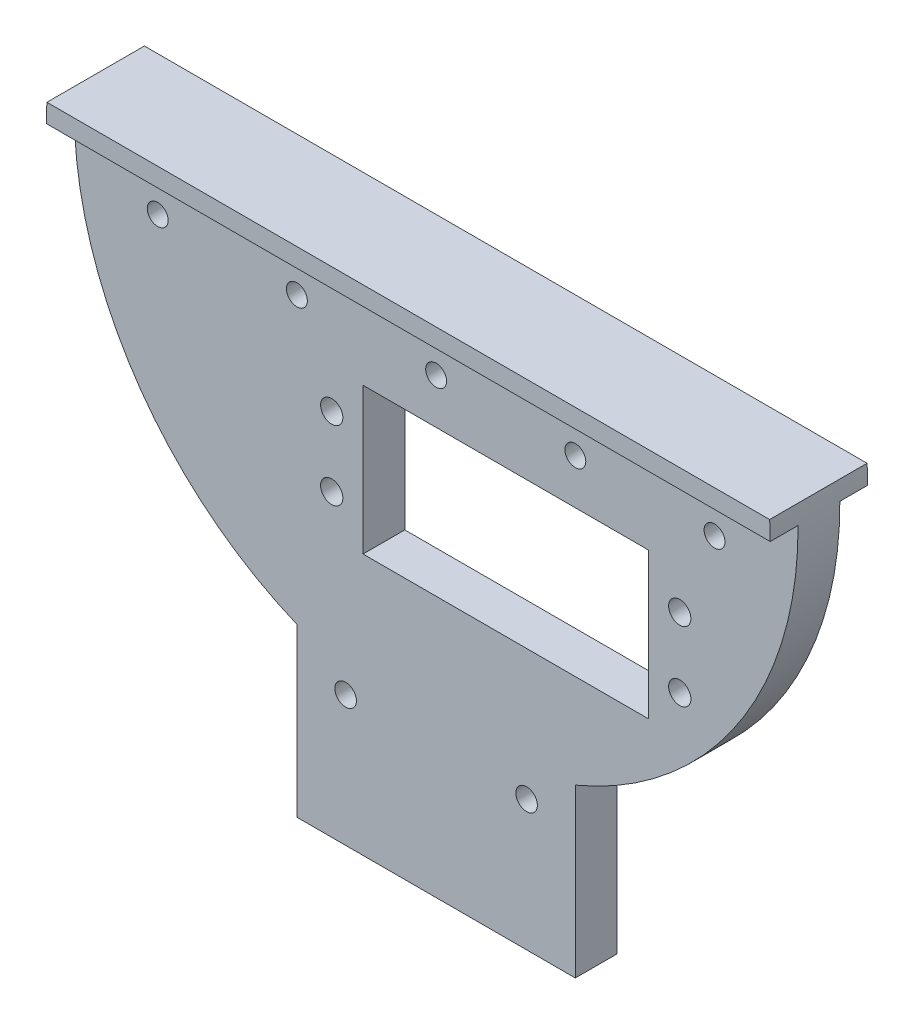
from build123d import *

# Parameters (mm, degrees)
SKETCH_1_R               = 1.6
SKETCH_1_R_2             = 1.5
SKETCH_1_W               = 41
SKETCH_1_H               = 21
EXTRUDE_1_DEPTH          = 14
CUT_EXTRUDE_1_DEPTH      = 87.973011371
CUT_EXTRUDE_1_DEPTH_BACK = 87.973011371
SKETCH_2_W               = 4
SKETCH_2_H               = 20
SKETCH_2_H_2             = 48.3
SKETCH_3_W               = 40
SKETCH_3_H               = 4
EXTRUDE_2_DEPTH          = 6
CUT_EXTRUDE_2_DEPTH      = 74.279789476
CUT_EXTRUDE_2_DEPTH_BACK = 74.279789476
SKETCH_4_R               = 1.55


with BuildPart() as part:
    # 草图1 → 凸台-拉伸1 (new body)
    with BuildSketch(Plane.XY):
        with BuildLine():
            Line((55.461772272, 46.736545732), (-48.365006547, 46.736545732))
            ThreePointArc((-48.365006547, 46.736545732), (-48.408359148, 45.857149327), (-48.436816123, 44.977144959))
            ThreePointArc((-48.436816123, 44.977144959), (-48.447916752, 44.35688949), (-48.451617137, 43.736545732))
            ThreePointArc((-48.451617137, 43.736545732), (-39.718232443, 14.892135528), (-16.451617137, -4.263454268))
            Line((-16.451617137, -4.263454268), (-16.451617137, -8.263454268))
            Line((-16.451617137, -8.263454268), (-16.451617137, -24.263454268))
            Line((-16.451617137, -24.263454268), (23.548382863, -24.263454268))
            Line((23.548382863, -24.263454268), (23.548382863, -8.263454268))
            Line((23.548382863, -8.263454268), (23.548382863, -4.263454268))
            ThreePointArc((23.548382863, -4.263454268), (46.814998168, 14.892135528), (55.548382863, 43.736545732))
            ThreePointArc((55.548382863, 43.736545732), (55.526725705, 45.237170718), (55.461772272, 46.736545732))
        make_face()
        with Locations((-11.451617137, 14.736545732)):
            Circle(SKETCH_1_R, mode=Mode.SUBTRACT)
        with Locations((-11.451617137, 24.736545732)):
            Circle(SKETCH_1_R, mode=Mode.SUBTRACT)
        with Locations((-36.451617137, 36.736545732)):
            Circle(SKETCH_1_R_2, mode=Mode.SUBTRACT)
        with Locations((-16.451617137, 36.736545732)):
            Circle(SKETCH_1_R_2, mode=Mode.SUBTRACT)
        with Locations((13.548382863, 19.736545732)):
            Rectangle(SKETCH_1_W, SKETCH_1_H, mode=Mode.SUBTRACT)
        with Locations((38.548382863, 14.736545732)):
            Circle(SKETCH_1_R, mode=Mode.SUBTRACT)
        with Locations((38.548382863, 24.736545732)):
            Circle(SKETCH_1_R, mode=Mode.SUBTRACT)
        with Locations((3.548382863, 36.736545732)):
            Circle(SKETCH_1_R_2, mode=Mode.SUBTRACT)
        with Locations((23.548382863, 36.736545732)):
            Circle(SKETCH_1_R_2, mode=Mode.SUBTRACT)
        with Locations((43.548382863, 36.736545732)):
            Circle(SKETCH_1_R_2, mode=Mode.SUBTRACT)
    extrude(amount=EXTRUDE_1_DEPTH)

    # 草图2 → 切除-拉伸1 (cut, two sides: drawn at the far end of the back side and taken through both)
    with BuildSketch(Plane(origin=(23.548382863, 0, 0), x_dir=(0, 0, -1), z_dir=(1, 0, 0)).offset(-CUT_EXTRUDE_1_DEPTH_BACK)):
        with Locations((-12, -14.263454268)):
            Rectangle(SKETCH_2_W, SKETCH_2_H)
        with Locations((-12, 19.886545732)):
            Rectangle(SKETCH_2_W, SKETCH_2_H_2)
        with Locations((-2, 19.886545732)):
            Rectangle(SKETCH_2_W, SKETCH_2_H_2)
        with Locations((-2, -14.263454268)):
            Rectangle(SKETCH_2_W, SKETCH_2_H)
    extrude(amount=CUT_EXTRUDE_1_DEPTH + CUT_EXTRUDE_1_DEPTH_BACK, mode=Mode.SUBTRACT)

    # 草图3 → 凸台-拉伸2 (add)
    with BuildSketch(Plane(origin=(0, 0, 4), x_dir=(-1, 0, 0), z_dir=(0, 0, -1))):
        with Locations((-3.548382863, -26.263454268)):
            Rectangle(SKETCH_3_W, SKETCH_3_H)
    extrude(amount=-EXTRUDE_2_DEPTH)

    # 草图4 → 切除-拉伸2 (cut, two sides: drawn at the far end of the back side and taken through both)
    with BuildSketch(Plane(origin=(0, 0, 4), x_dir=(-1, 0, 0), z_dir=(0, 0, -1)).offset(-CUT_EXTRUDE_2_DEPTH_BACK)):
        with Locations((-16.548382863, -9.513454268)):
            Circle(SKETCH_4_R)
        with Locations((9.451617137, -9.513454268)):
            Circle(SKETCH_4_R)
    extrude(amount=CUT_EXTRUDE_2_DEPTH + CUT_EXTRUDE_2_DEPTH_BACK, mode=Mode.SUBTRACT)


solid = part.part
